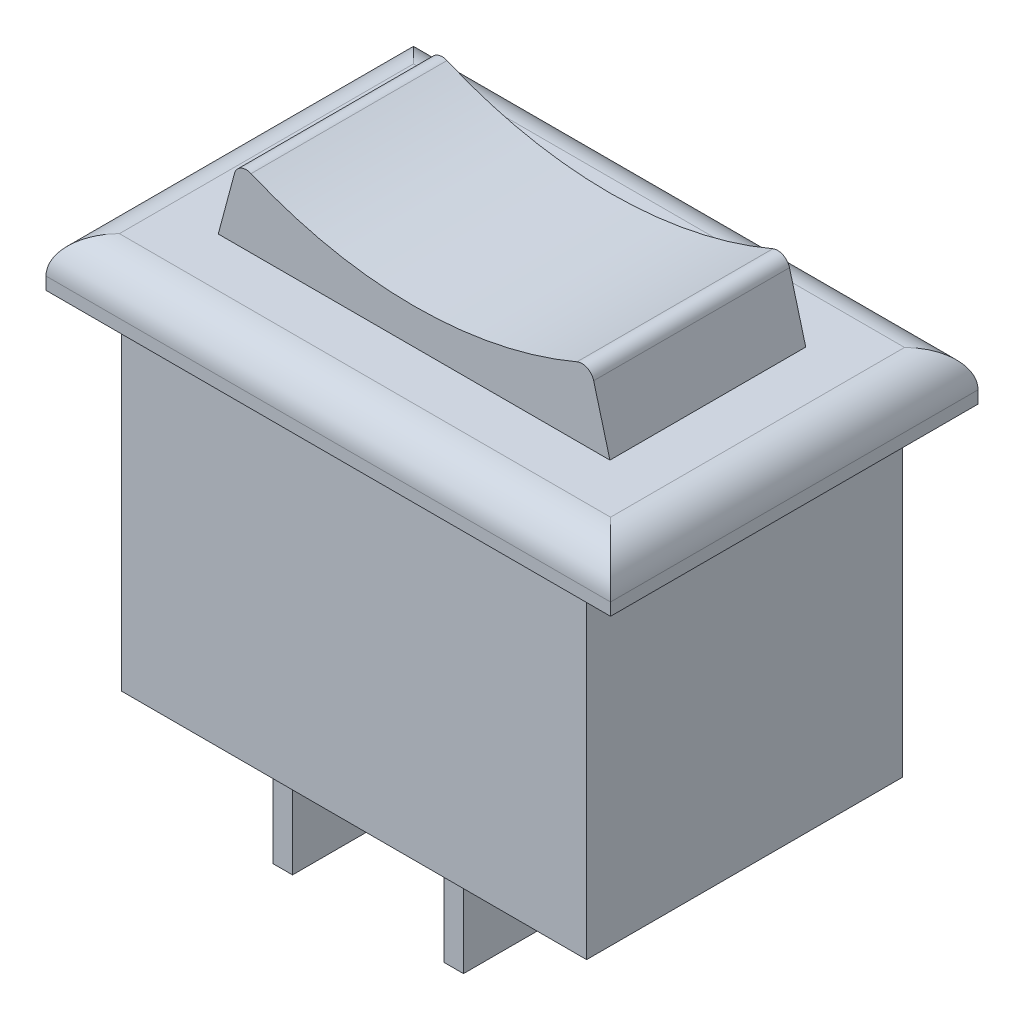
from build123d import *

# Parameters (mm, degrees)
BOSS_EXTRUDE1_DEPTH      = 15.0114
SKETCH2_W                = 1.0541
SKETCH2_H                = 13.6906
CUT_EXTRUDE1_DEPTH       = 31.735742265
FILLET1_R                = 1.5
SKETCH4_W                = 0.7874
SKETCH4_H                = 7.0866
BOSS_EXTRUDE2_DEPTH      = 12.9032
SKETCH5_W                = 4.0767
SKETCH5_H                = 7.0866
CUT_EXTRUDE2_DEPTH       = 34.156380129
BOSS_EXTRUDE3_DEPTH      = 4
BOSS_EXTRUDE3_DEPTH_BACK = 4


with BuildPart() as part:
    # Sketch1 → Boss-Extrude1 (new body)
    with BuildSketch(Plane.XY):
        Polygon((-2.032, 0), (0, 0), (0, -13.6906), (18.9992, -13.6906), (18.9992, 0), (21.0312, 0), (21.0312, 2.0066), (-2.032, 2.0066), align=None)
    extrude(amount=BOSS_EXTRUDE1_DEPTH)

    # Sketch2 → Cut-Extrude1 (cut, through all)
    with BuildSketch(Plane(origin=(21.0312, 0, 0), x_dir=(0, 0, -1), z_dir=(1, 0, 0))):
        with Locations((-14.48435, -6.8453)):
            Rectangle(SKETCH2_W, SKETCH2_H)
        with Locations((-0.52705, -6.8453)):
            Rectangle(SKETCH2_W, SKETCH2_H)
    extrude(amount=-CUT_EXTRUDE1_DEPTH, mode=Mode.SUBTRACT)

    # Fillet1
    fillet1_edges = [part.edges().sort_by_distance(p)[0] for p in [
        (-2.032, 2.0066, 7.5057),
        (21.0312, 2.0066, 7.5057),
        (9.4996, 2.0066, 15.0114),
        (9.4996, 2.0066, 0),
    ]]
    fillet(fillet1_edges, radius=FILLET1_R)

    # Sketch4 → Boss-Extrude2 (add)
    with BuildSketch(Plane.XY.offset(13.9573)):
        with Locations((2.5146, -17.2339)):
            Rectangle(SKETCH4_W, SKETCH4_H)
        with Locations((9.4996, -17.2339)):
            Rectangle(SKETCH4_W, SKETCH4_H)
    extrude(amount=-BOSS_EXTRUDE2_DEPTH)

    # Sketch5 → Cut-Extrude2 (cut, through all)
    with BuildSketch(Plane.ZY):
        with Locations((3.09245, -17.2339)):
            Rectangle(SKETCH5_W, SKETCH5_H)
        with Locations((11.91895, -17.2339)):
            Rectangle(SKETCH5_W, SKETCH5_H)
    extrude(amount=-CUT_EXTRUDE2_DEPTH, mode=Mode.SUBTRACT)

    # Sketch6 → Boss-Extrude3 (add, two sides: drawn at the far end of the back side and taken through both)
    with BuildSketch(Plane.XY.offset(7.5057).offset(-BOSS_EXTRUDE3_DEPTH_BACK)):
        with BuildLine():
            Line((2.163304729, 4.48357977), (1.4996, 2.0066))
            Line((1.4996, 2.0066), (17.4996, 2.0066))
            Line((17.4996, 2.0066), (16.835895271, 4.48357977))
            ThreePointArc((16.835895271, 4.48357977), (16.571901131, 4.803672947), (16.157122862, 4.814233984))
            ThreePointArc((16.157122862, 4.814233984), (9.4996, 3.456401012), (2.842077138, 4.814233984))
            ThreePointArc((2.842077138, 4.814233984), (2.427298869, 4.803672947), (2.163304729, 4.48357977))
        make_face()
    extrude(amount=BOSS_EXTRUDE3_DEPTH + BOSS_EXTRUDE3_DEPTH_BACK)


solid = part.part
